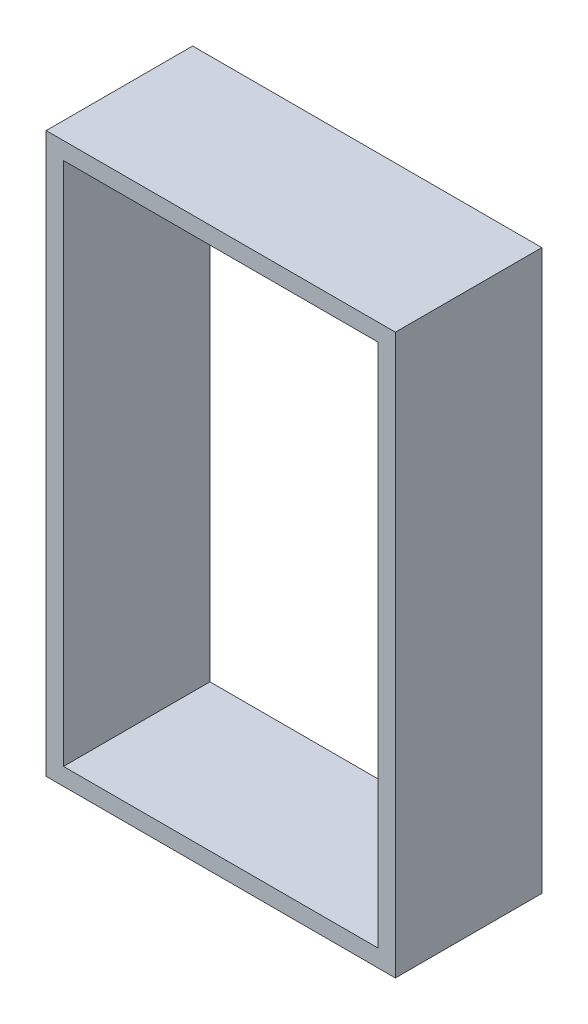
from build123d import *

# Parameters (mm, degrees)
STRAP_SKETCH_W   = 30.28
STRAP_SKETCH_H   = 48.5
STRAP_SKETCH_W_2 = 27.28
STRAP_SKETCH_H_2 = 45.5
STRAP_DEPTH      = 6.35


with BuildPart() as part:
    # Strap Sketch → Strap (new, symmetric)
    with BuildSketch(Plane.XY):
        with Locations((-10.41, -20)):
            Rectangle(STRAP_SKETCH_W, STRAP_SKETCH_H)
        with Locations((-10.41, -20)):
            Rectangle(STRAP_SKETCH_W_2, STRAP_SKETCH_H_2, mode=Mode.SUBTRACT)
    extrude(amount=STRAP_DEPTH, both=True)


solid = part.part
